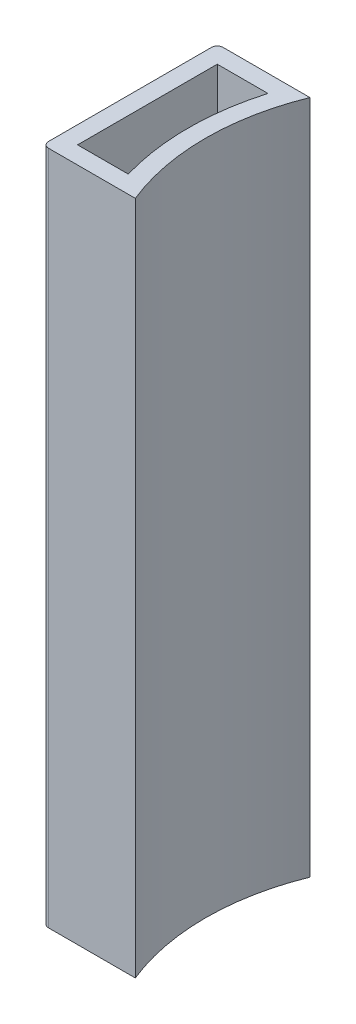
from build123d import *

# Parameters (mm, degrees)
BOSS_EXTRUDE1_DEPTH = 116
SHELL1_T            = -3
FILLET1_R           = 1
CUT_EXTRUDE1_DEPTH  = 3


with BuildPart() as part:
    # Sketch1 → Boss-Extrude1 (new body)
    with BuildSketch(Plane(origin=(0, 0, 0), x_dir=(1, 0, 0), z_dir=(0, 1, 0))):
        with BuildLine():
            ThreePointArc((15.919007565, 0), (13, -15), (15.919007565, -30))
            Line((15.919007565, -30), (0, -30))
            Line((0, -30), (0, 0))
            Line((0, 0), (15.919007565, 0))
        make_face()
    extrude(amount=BOSS_EXTRUDE1_DEPTH)

    # Shell1
    shell1_openings = [part.faces().sort_by_distance(p)[0] for p in [
        (7.006000275, 116, 15),
        (7.006000275, 0, 15),
    ]]
    offset(amount=SHELL1_T, openings=shell1_openings, kind=Kind.INTERSECTION)

    # Fillet1
    fillet1_edges = [part.edges().sort_by_distance(p)[0] for p in [
        (0, 58, 30),
        (0, 58, 0),
    ]]
    fillet(fillet1_edges, radius=FILLET1_R)

    # Sketch2 → Cut-Extrude1 (cut)
    with BuildSketch(Plane.ZY):
        with BuildLine():
            Line((19, 96), (19, 20))
            ThreePointArc((19, 20), (15, 16), (11, 20))
            Line((11, 20), (11, 96))
            ThreePointArc((11, 96), (15, 100), (19, 96))
        make_face()
    extrude(amount=-CUT_EXTRUDE1_DEPTH, mode=Mode.SUBTRACT)


solid = part.part
